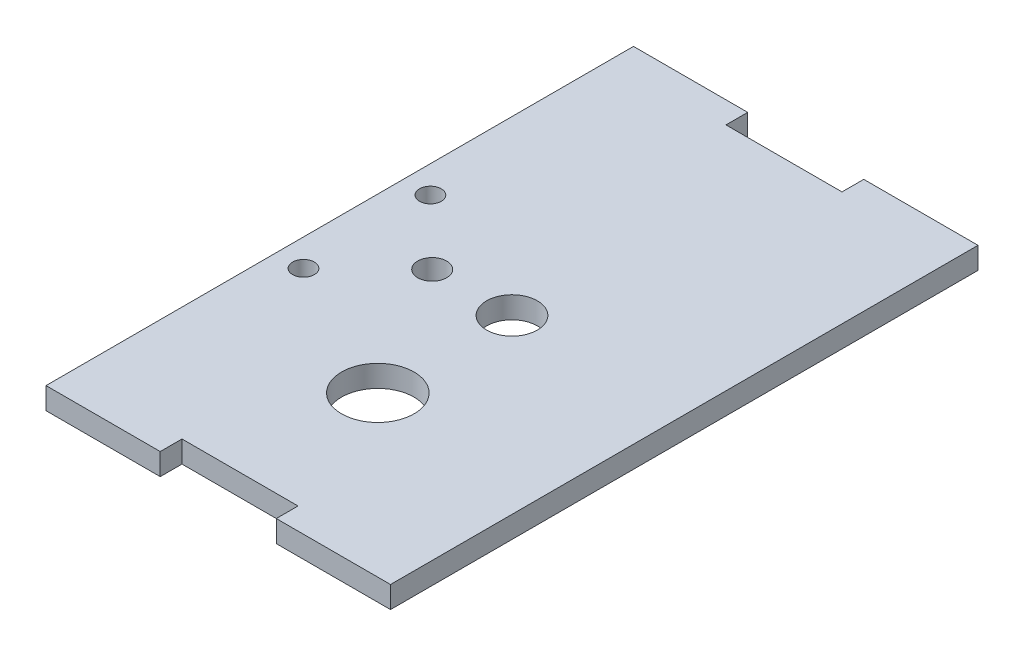
from build123d import *

# Parameters (mm, degrees)
CROQUIS1_R              = 1.5
CROQUIS1_R_2            = 2
CROQUIS1_R_3            = 5
CROQUIS1_R_4            = 3.5
SALIENTE_EXTRUIR1_DEPTH = 3


with BuildPart() as part:
    # Croquis1 → Saliente-Extruir1 (new body)
    with BuildSketch(Plane(origin=(0, 0, 0), x_dir=(1, 0, 0), z_dir=(0, 1, 0))):
        Polygon((0, 0), (15.75, 0), (15.75, 3), (23.75, 3), (31.75, 3), (31.75, 0), (47.5, 0), (47.5, 81), (31.75, 81), (31.75, 78), (23.75, 78), (15.75, 78), (15.75, 81), (0, 81), align=None)
        with Locations(Location((3.75, 49.25, 0), (0, 0, 270))):
            Circle(CROQUIS1_R, mode=Mode.SUBTRACT)
        with Locations(Location((3.75, 31.75, 0), (0, 0, 90))):
            Circle(CROQUIS1_R, mode=Mode.SUBTRACT)
        with Locations(Location((12.75, 40.5, 0), (0, 0, 270))):
            Circle(CROQUIS1_R_2, mode=Mode.SUBTRACT)
        with Locations(Location((23.75, 22, 0), (0, 0, 270))):
            Circle(CROQUIS1_R_3, mode=Mode.SUBTRACT)
        with Locations(Location((23.75, 40.5, 0), (0, 0, 270))):
            Circle(CROQUIS1_R_4, mode=Mode.SUBTRACT)
    extrude(amount=SALIENTE_EXTRUIR1_DEPTH)


solid = part.part
